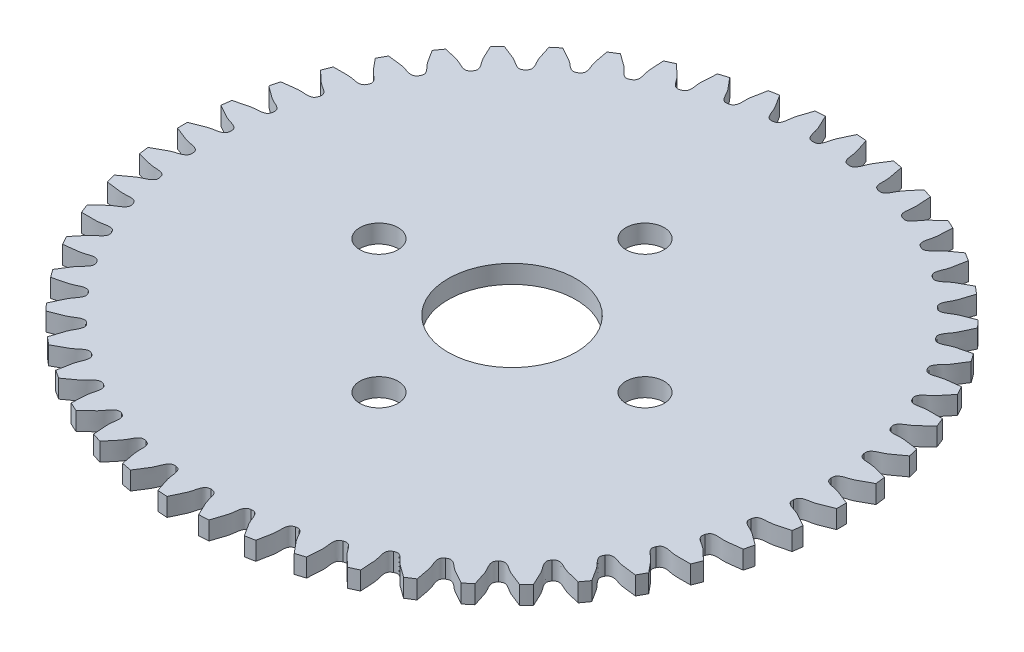
from build123d import *

# Parameters (mm, degrees)
SKETCH1_R      = 4
SKETCH1_R_2    = 1.2
EXTRUDE1_DEPTH = 1.143


with BuildPart() as part:
    # Sketch1 → Extrude1 (new body)
    with BuildSketch(Plane(origin=(0, 0, 0), x_dir=(1, 0, 0), z_dir=(0, 1, 0))):
        with BuildLine():
            ThreePointArc((-11.316727277, -17.257986267), (-11.058125481, -17.424817563), (-10.797064722, -17.587774152))
            add(Edge.make_bspline(
                [(-10.797064722, -17.587774152), (-10.668562717, -17.499911877), (-10.325145211, -17.265102752), (-9.872997884, -16.927766721), (-9.576781921, -16.550411077), (-9.287806909, -16.413373597), (-9.143697884, -16.479266354), (-9.076456009, -16.51001219)],
                knots=[0, 0, 0, 0, 0.220153706, 0.588353748, 0.785743053, 0.90002681, 1, 1, 1, 1], degree=3))
            add(Edge.make_bspline(
                [(-9.064492279, -18.540263913), (-9.059162524, -18.38468712), (-9.044918924, -17.968913109), (-9.002369346, -17.40639881), (-8.842477888, -16.954098135), (-8.881613871, -16.636680109), (-9.014466443, -16.55031194), (-9.076456009, -16.51001219)],
                knots=[0, 0, 0, 0, 0.220153706, 0.588353748, 0.785743053, 0.90002681, 1, 1, 1, 1], degree=3))
            ThreePointArc((-9.064492279, -18.540263913), (-8.78702013, -18.673368295), (-8.507594036, -18.802320335))
            add(Edge.make_bspline(
                [(-8.507594036, -18.802320335), (-8.39111737, -18.699045307), (-8.079837201, -18.423046096), (-7.673534607, -18.031700974), (-7.426949598, -17.620195187), (-7.15742859, -17.448020116), (-7.006197356, -17.495331639), (-6.935632229, -17.517407394)],
                knots=[0, 0, 0, 0, 0.220153706, 0.588353748, 0.785743053, 0.90002681, 1, 1, 1, 1], degree=3))
            add(Edge.make_bspline(
                [(-6.669304822, -19.530150523), (-6.683516037, -19.375132503), (-6.721495053, -18.960851798), (-6.749782727, -18.397440216), (-6.647840367, -17.928666353), (-6.726450779, -17.618656303), (-6.86908057, -17.549620015), (-6.935632229, -17.517407394)],
                knots=[0, 0, 0, 0, 0.220153706, 0.588353748, 0.785743053, 0.90002681, 1, 1, 1, 1], degree=3))
            ThreePointArc((-6.669304822, -19.530150523), (-6.377338221, -19.627428855), (-6.08395351, -19.720342693))
            add(Edge.make_bspline(
                [(-6.08395351, -19.720342693), (-5.981339091, -19.603283623), (-5.707105332, -19.290446998), (-5.353055105, -18.851264531), (-5.159989843, -18.412098294), (-4.914173348, -18.207500935), (-4.758204911, -18.235485093), (-4.685429385, -18.248542618)],
                knots=[0, 0, 0, 0, 0.220153706, 0.588353748, 0.785743053, 0.90002681, 1, 1, 1, 1], degree=3))
            add(Edge.make_bspline(
                [(-4.168938445, -20.212034991), (-4.202466509, -20.060020473), (-4.29206919, -19.653766528), (-4.390748002, -19.098343), (-4.348362433, -18.620488794), (-4.46520754, -18.322775762), (-4.615365194, -18.272160099), (-4.685429385, -18.248542618)],
                knots=[0, 0, 0, 0, 0.220153706, 0.588353748, 0.785743053, 0.90002681, 1, 1, 1, 1], degree=3))
            ThreePointArc((-4.168938445, -20.212034991), (-3.86708188, -20.271953137), (-3.564365403, -20.327363467))
            add(Edge.make_bspline(
                [(-3.564365403, -20.327363467), (-3.47723152, -20.198366446), (-3.244369003, -19.853626027), (-2.948154726, -19.373532385), (-2.811653966, -18.913631611), (-2.593418656, -18.679838588), (-2.435172732, -18.688054054), (-2.36133452, -18.691887424)],
                knots=[0, 0, 0, 0, 0.220153706, 0.588353748, 0.785743053, 0.90002681, 1, 1, 1, 1], degree=3))
            add(Edge.make_bspline(
                [(-1.602825418, -20.575163594), (-1.655141574, -20.428549936), (-1.794954832, -20.036729619), (-1.962468559, -19.498053506), (-1.980308225, -19.018655002), (-2.133545311, -18.737934102), (-2.288862752, -18.706537302), (-2.36133452, -18.691887424)],
                knots=[0, 0, 0, 0, 0.220153706, 0.588353748, 0.785743053, 0.90002681, 1, 1, 1, 1], degree=3))
            ThreePointArc((-1.602825418, -20.575163594), (-1.295839347, -20.596776608), (-0.988565124, -20.613809576))
            add(Edge.make_bspline(
                [(-0.988565124, -20.613809576), (-0.918285932, -20.474908964), (-0.730467036, -20.103701514), (-0.496760186, -19.590268061), (-0.418976626, -19.11688566), (-0.231764202, -18.857584027), (-0.073736424, -18.845901238), (0, -18.84045)],
                knots=[0, 0, 0, 0, 0.220153706, 0.588353748, 0.785743053, 0.90002681, 1, 1, 1, 1], degree=3))
            add(Edge.make_bspline(
                [(0.988565124, -20.613809576), (0.918285932, -20.474908964), (0.730467036, -20.103701514), (0.496760186, -19.590268061), (0.418976626, -19.11688566), (0.231764202, -18.857584027), (0.073736424, -18.845901238), (0, -18.84045)],
                knots=[0, 0, 0, 0, 0.220153706, 0.588353748, 0.785743053, 0.90002681, 1, 1, 1, 1], degree=3))
            ThreePointArc((0.988565124, -20.613809576), (1.295839347, -20.596776608), (1.602825418, -20.575163594))
            add(Edge.make_bspline(
                [(1.602825418, -20.575163594), (1.655141574, -20.428549936), (1.794954832, -20.036729619), (1.962468559, -19.498053506), (1.980308225, -19.018655002), (2.133545311, -18.737934102), (2.288862752, -18.706537302), (2.36133452, -18.691887424)],
                knots=[0, 0, 0, 0, 0.220153706, 0.588353748, 0.785743053, 0.90002681, 1, 1, 1, 1], degree=3))
            add(Edge.make_bspline(
                [(3.564365403, -20.327363467), (3.47723152, -20.198366446), (3.244369003, -19.853626027), (2.948154726, -19.373532385), (2.811653966, -18.913631611), (2.593418656, -18.679838588), (2.435172732, -18.688054054), (2.36133452, -18.691887424)],
                knots=[0, 0, 0, 0, 0.220153706, 0.588353748, 0.785743053, 0.90002681, 1, 1, 1, 1], degree=3))
            ThreePointArc((3.564365403, -20.327363467), (3.86708188, -20.271953137), (4.168938445, -20.212034991))
            add(Edge.make_bspline(
                [(4.168938445, -20.212034991), (4.202466509, -20.060020473), (4.29206919, -19.653766528), (4.390748002, -19.098343), (4.348362433, -18.620488794), (4.46520754, -18.322775762), (4.615365194, -18.272160099), (4.685429385, -18.248542618)],
                knots=[0, 0, 0, 0, 0.220153706, 0.588353748, 0.785743053, 0.90002681, 1, 1, 1, 1], degree=3))
            add(Edge.make_bspline(
                [(6.08395351, -19.720342693), (5.981339091, -19.603283623), (5.707105332, -19.290446998), (5.353055105, -18.851264531), (5.159989843, -18.412098294), (4.914173348, -18.207500935), (4.758204911, -18.235485093), (4.685429385, -18.248542618)],
                knots=[0, 0, 0, 0, 0.220153706, 0.588353748, 0.785743053, 0.90002681, 1, 1, 1, 1], degree=3))
            ThreePointArc((6.08395351, -19.720342693), (6.377338221, -19.627428855), (6.669304822, -19.530150523))
            add(Edge.make_bspline(
                [(6.669304822, -19.530150523), (6.683516037, -19.375132503), (6.721495053, -18.960851798), (6.749782727, -18.397440216), (6.647840367, -17.928666353), (6.726450779, -17.618656303), (6.86908057, -17.549620015), (6.935632229, -17.517407394)],
                knots=[0, 0, 0, 0, 0.220153706, 0.588353748, 0.785743053, 0.90002681, 1, 1, 1, 1], degree=3))
            add(Edge.make_bspline(
                [(8.507594036, -18.802320335), (8.39111737, -18.699045307), (8.079837201, -18.423046096), (7.673534607, -18.031700974), (7.426949598, -17.620195187), (7.15742859, -17.448020116), (7.006197356, -17.495331639), (6.935632229, -17.517407394)],
                knots=[0, 0, 0, 0, 0.220153706, 0.588353748, 0.785743053, 0.90002681, 1, 1, 1, 1], degree=3))
            ThreePointArc((8.507594036, -18.802320335), (8.78702013, -18.673368295), (9.064492279, -18.540263913))
            add(Edge.make_bspline(
                [(9.064492279, -18.540263913), (9.059162524, -18.38468712), (9.044918924, -17.968913109), (9.002369346, -17.40639881), (8.842477888, -16.954098135), (8.881613871, -16.636680109), (9.014466443, -16.55031194), (9.076456009, -16.51001219)],
                knots=[0, 0, 0, 0, 0.220153706, 0.588353748, 0.785743053, 0.90002681, 1, 1, 1, 1], degree=3))
            add(Edge.make_bspline(
                [(10.797064722, -17.587774152), (10.668562717, -17.499911877), (10.325145211, -17.265102752), (9.872997884, -16.927766721), (9.576781921, -16.550411077), (9.287806909, -16.413373597), (9.143697884, -16.479266354), (9.076456009, -16.51001219)],
                knots=[0, 0, 0, 0, 0.220153706, 0.588353748, 0.785743053, 0.90002681, 1, 1, 1, 1], degree=3))
            ThreePointArc((10.797064722, -17.587774152), (11.058125481, -17.424817563), (11.316727277, -17.257986267))
            add(Edge.make_bspline(
                [(11.316727277, -17.257986267), (11.291940606, -17.104304238), (11.225699021, -16.693593926), (11.112983222, -16.140848097), (10.89766425, -15.712153661), (10.896708607, -15.392333531), (11.017688794, -15.289995559), (11.074138657, -15.242244232)],
                knots=[0, 0, 0, 0, 0.220153706, 0.588353748, 0.785743053, 0.90002681, 1, 1, 1, 1], degree=3))
            add(Edge.make_bspline(
                [(12.916259248, -16.095858265), (12.777758456, -16.024794382), (12.407619512, -15.834878424), (11.916758087, -15.556871474), (11.575582672, -15.219617097), (11.271710963, -15.119878371), (11.136996834, -15.203313194), (11.074138657, -15.242244232)],
                knots=[0, 0, 0, 0, 0.220153706, 0.588353748, 0.785743053, 0.90002681, 1, 1, 1, 1], degree=3))
            ThreePointArc((12.916259248, -16.095858265), (13.154837588, -15.901467048), (13.390490726, -15.703539867))
            add(Edge.make_bspline(
                [(13.390490726, -15.703539867), (13.34663804, -15.554176261), (13.229443137, -15.155006794), (13.048338714, -14.620746567), (12.780987937, -14.222419137), (12.739955738, -13.905240659), (12.847155612, -13.788546814), (12.897175522, -13.734096977)],
                knots=[0, 0, 0, 0, 0.220153706, 0.588353748, 0.785743053, 0.90002681, 1, 1, 1, 1], degree=3))
            add(Edge.make_bspline(
                [(14.831756649, -14.350101078), (14.685441311, -14.296956307), (14.294418243, -14.154928603), (13.772583896, -13.940635071), (13.391829569, -13.648800663), (13.077853403, -13.587933631), (12.954658691, -13.687594703), (12.897175522, -13.734096977)],
                knots=[0, 0, 0, 0, 0.220153706, 0.588353748, 0.785743053, 0.90002681, 1, 1, 1, 1], degree=3))
            ThreePointArc((14.831756649, -14.350101078), (15.044090048, -14.127340899), (15.253078137, -13.901439263))
            add(Edge.make_bspline(
                [(15.253078137, -13.901439263), (15.190851019, -13.758749633), (15.024551033, -13.377416152), (14.777914111, -12.870067129), (14.462747809, -12.508388568), (14.382286157, -12.198853835), (14.474015111, -12.069644449), (14.516816225, -12.009354808)],
                knots=[0, 0, 0, 0, 0.220153706, 0.588353748, 0.785743053, 0.90002681, 1, 1, 1, 1], degree=3))
            add(Edge.make_bspline(
                [(16.513348388, -12.378034225), (16.361525984, -12.34364669), (15.955785458, -12.251747103), (15.41120783, -12.104546526), (14.996879314, -11.86273449), (14.677750282, -11.841699061), (14.568017842, -11.956014667), (14.516816225, -12.009354808)],
                knots=[0, 0, 0, 0, 0.220153706, 0.588353748, 0.785743053, 0.90002681, 1, 1, 1, 1], degree=3))
            ThreePointArc((16.513348388, -12.378034225), (16.696088221, -12.130418144), (16.875115394, -11.880104658))
            add(Edge.make_bspline(
                [(16.875115394, -11.880104658), (16.795495203, -11.746339303), (16.582712784, -11.388855667), (16.274432973, -10.916419045), (15.916421509, -10.597093239), (15.797799332, -10.300083799), (15.872610745, -10.160396581), (15.907518064, -10.095217939)],
                knots=[0, 0, 0, 0, 0.220153706, 0.588353748, 0.785743053, 0.90002681, 1, 1, 1, 1], degree=3))
            add(Edge.make_bspline(
                [(17.934514758, -10.210758377), (17.779579618, -10.195670392), (17.365520405, -10.155348232), (16.80678781, -10.077562051), (16.365419314, -9.889585908), (16.046170272, -9.908713822), (15.951630648, -10.035881137), (15.907518064, -10.095217939)],
                knots=[0, 0, 0, 0, 0.220153706, 0.588353748, 0.785743053, 0.90002681, 1, 1, 1, 1], degree=3))
            ThreePointArc((17.934514758, -10.210758377), (18.084779109, -9.942191449), (18.231022001, -9.671413705))
            add(Edge.make_bspline(
                [(18.231022001, -9.671413705), (18.135264394, -9.548682187), (17.879355248, -9.220686124), (17.514294306, -8.790612511), (17.119083733, -8.518675419), (16.964171774, -8.238875288), (17.020885826, -8.090913189), (17.047348841, -8.021873454)],
                knots=[0, 0, 0, 0, 0.220153706, 0.588353748, 0.785743053, 0.90002681, 1, 1, 1, 1], degree=3))
            add(Edge.make_bspline(
                [(19.072843117, -7.882452771), (18.917238661, -7.88690228), (18.501390722, -7.898793453), (17.937314706, -7.891648402), (17.475866875, -7.760472648), (17.16153257, -7.819462248), (17.083676711, -7.957475767), (17.047348841, -8.021873454)],
                knots=[0, 0, 0, 0, 0.220153706, 0.588353748, 0.785743053, 0.90002681, 1, 1, 1, 1], degree=3))
            ThreePointArc((19.072843117, -7.882452771), (19.188262228, -7.597170456), (19.2994145, -7.310198781))
            add(Edge.make_bspline(
                [(19.2994145, -7.310198781), (19.189029632, -7.200436647), (18.894029599, -6.907100852), (18.477944756, -6.526172767), (18.051767781, -6.305912999), (17.863009094, -6.047734792), (17.90073137, -5.893831263), (17.918332742, -5.822019232)],
                knots=[0, 0, 0, 0, 0.220153706, 0.588353748, 0.785743053, 0.90002681, 1, 1, 1, 1], degree=3))
            add(Edge.make_bspline(
                [(19.910381346, -5.429836175), (19.756561549, -5.453753009), (19.345483055, -5.517669983), (18.784959435, -5.581278743), (18.310709576, -5.508972098), (18.006247248, -5.606893083), (17.946302986, -5.753576251), (17.918332742, -5.822019232)],
                knots=[0, 0, 0, 0, 0.220153706, 0.588353748, 0.785743053, 0.90002681, 1, 1, 1, 1], degree=3))
            ThreePointArc((19.910381346, -5.429836175), (19.989134988, -5.132337546), (20.063443703, -4.833697655))
            add(Edge.make_bspline(
                [(20.063443703, -4.833697655), (19.94017241, -4.738635921), (19.610733816, -4.484586474), (19.150186978, -4.15881138), (18.699764667, -3.993702564), (18.480136089, -3.761217906), (18.498271687, -3.603800098), (18.506733833, -3.530348288)],
                knots=[0, 0, 0, 0, 0.220153706, 0.588353748, 0.785743053, 0.90002681, 1, 1, 1, 1], degree=3))
            add(Edge.make_bspline(
                [(20.433920968, -2.891587819), (20.28431166, -2.934594794), (19.884485563, -3.049529561), (19.336354131, -3.182888985), (18.856781449, -3.170591767), (18.566992651, -3.305899864), (18.525905343, -3.4589394), (18.506733833, -3.530348288)],
                knots=[0, 0, 0, 0, 0.220153706, 0.588353748, 0.785743053, 0.90002681, 1, 1, 1, 1], degree=3))
            ThreePointArc((20.433920968, -2.891587819), (20.474767148, -2.586564608), (20.511060414, -2.280966229))
            add(Edge.make_bspline(
                [(20.511060414, -2.280966229), (20.376846757, -2.202104075), (20.018165047, -1.991347489), (19.520419311, -1.725863052), (19.052855093, -1.618509054), (18.805820298, -1.415384367), (18.804083209, -1.256934852), (18.803272676, -1.183001644)],
                knots=[0, 0, 0, 0, 0.220153706, 0.588353748, 0.785743053, 0.90002681, 1, 1, 1, 1], degree=3))
            add(Edge.make_bspline(
                [(20.63520545, -0.307737396), (20.492166059, -0.369156267), (20.109897856, -0.533296236), (19.582802972, -0.734303166), (19.105470613, -0.782209311), (18.834925488, -0.95277063), (18.813343106, -1.109753008), (18.803272676, -1.183001644)],
                knots=[0, 0, 0, 0, 0.220153706, 0.588353748, 0.785743053, 0.90002681, 1, 1, 1, 1], degree=3))
            ThreePointArc((20.63520545, -0.307737396), (20.6375, 0), (20.63520545, 0.307737396))
            add(Edge.make_bspline(
                [(20.63520545, 0.307737396), (20.492166059, 0.369156267), (20.109897856, 0.533296236), (19.582802972, 0.734303166), (19.105470613, 0.782209311), (18.834925488, 0.95277063), (18.813343106, 1.109753008), (18.803272676, 1.183001644)],
                knots=[0, 0, 0, 0, 0.220153706, 0.588353748, 0.785743053, 0.90002681, 1, 1, 1, 1], degree=3))
            add(Edge.make_bspline(
                [(20.511060414, 2.280966229), (20.376846757, 2.202104075), (20.018165047, 1.991347489), (19.520419311, 1.725863052), (19.052855093, 1.618509054), (18.805820298, 1.415384367), (18.804083209, 1.256934852), (18.803272676, 1.183001644)],
                knots=[0, 0, 0, 0, 0.220153706, 0.588353748, 0.785743053, 0.90002681, 1, 1, 1, 1], degree=3))
            ThreePointArc((20.511060414, 2.280966229), (20.474767148, 2.586564608), (20.433920968, 2.891587819))
            add(Edge.make_bspline(
                [(20.433920968, 2.891587819), (20.28431166, 2.934594794), (19.884485563, 3.049529561), (19.336354131, 3.182888985), (18.856781449, 3.170591767), (18.566992651, 3.305899864), (18.525905343, 3.4589394), (18.506733833, 3.530348288)],
                knots=[0, 0, 0, 0, 0.220153706, 0.588353748, 0.785743053, 0.90002681, 1, 1, 1, 1], degree=3))
            add(Edge.make_bspline(
                [(20.063443703, 4.833697655), (19.94017241, 4.738635921), (19.610733816, 4.484586474), (19.150186978, 4.15881138), (18.699764667, 3.993702564), (18.480136089, 3.761217906), (18.498271687, 3.603800098), (18.506733833, 3.530348288)],
                knots=[0, 0, 0, 0, 0.220153706, 0.588353748, 0.785743053, 0.90002681, 1, 1, 1, 1], degree=3))
            ThreePointArc((20.063443703, 4.833697655), (19.989134988, 5.132337546), (19.910381346, 5.429836175))
            add(Edge.make_bspline(
                [(19.910381346, 5.429836175), (19.756561549, 5.453753009), (19.345483055, 5.517669983), (18.784959435, 5.581278743), (18.310709576, 5.508972098), (18.006247248, 5.606893083), (17.946302986, 5.753576251), (17.918332742, 5.822019232)],
                knots=[0, 0, 0, 0, 0.220153706, 0.588353748, 0.785743053, 0.90002681, 1, 1, 1, 1], degree=3))
            add(Edge.make_bspline(
                [(19.2994145, 7.310198781), (19.189029632, 7.200436647), (18.894029599, 6.907100852), (18.477944756, 6.526172767), (18.051767781, 6.305912999), (17.863009094, 6.047734792), (17.90073137, 5.893831263), (17.918332742, 5.822019232)],
                knots=[0, 0, 0, 0, 0.220153706, 0.588353748, 0.785743053, 0.90002681, 1, 1, 1, 1], degree=3))
            ThreePointArc((19.2994145, 7.310198781), (19.188262228, 7.597170456), (19.072843117, 7.882452771))
            add(Edge.make_bspline(
                [(19.072843117, 7.882452771), (18.917238661, 7.88690228), (18.501390722, 7.898793453), (17.937314706, 7.891648402), (17.475866875, 7.760472648), (17.16153257, 7.819462248), (17.083676711, 7.957475767), (17.047348841, 8.021873454)],
                knots=[0, 0, 0, 0, 0.220153706, 0.588353748, 0.785743053, 0.90002681, 1, 1, 1, 1], degree=3))
            add(Edge.make_bspline(
                [(18.231022001, 9.671413705), (18.135264394, 9.548682187), (17.879355248, 9.220686124), (17.514294306, 8.790612511), (17.119083733, 8.518675419), (16.964171774, 8.238875288), (17.020885826, 8.090913189), (17.047348841, 8.021873454)],
                knots=[0, 0, 0, 0, 0.220153706, 0.588353748, 0.785743053, 0.90002681, 1, 1, 1, 1], degree=3))
            ThreePointArc((18.231022001, 9.671413705), (18.084779109, 9.942191449), (17.934514758, 10.210758377))
            add(Edge.make_bspline(
                [(17.934514758, 10.210758377), (17.779579618, 10.195670392), (17.365520405, 10.155348232), (16.80678781, 10.077562051), (16.365419314, 9.889585908), (16.046170272, 9.908713822), (15.951630648, 10.035881137), (15.907518064, 10.095217939)],
                knots=[0, 0, 0, 0, 0.220153706, 0.588353748, 0.785743053, 0.90002681, 1, 1, 1, 1], degree=3))
            add(Edge.make_bspline(
                [(16.875115394, 11.880104658), (16.795495203, 11.746339303), (16.582712784, 11.388855667), (16.274432973, 10.916419045), (15.916421509, 10.597093239), (15.797799332, 10.300083799), (15.872610745, 10.160396581), (15.907518064, 10.095217939)],
                knots=[0, 0, 0, 0, 0.220153706, 0.588353748, 0.785743053, 0.90002681, 1, 1, 1, 1], degree=3))
            ThreePointArc((16.875115394, 11.880104658), (16.696088221, 12.130418144), (16.513348388, 12.378034225))
            add(Edge.make_bspline(
                [(16.513348388, 12.378034225), (16.361525984, 12.34364669), (15.955785458, 12.251747103), (15.41120783, 12.104546526), (14.996879314, 11.86273449), (14.677750282, 11.841699061), (14.568017842, 11.956014667), (14.516816225, 12.009354808)],
                knots=[0, 0, 0, 0, 0.220153706, 0.588353748, 0.785743053, 0.90002681, 1, 1, 1, 1], degree=3))
            add(Edge.make_bspline(
                [(15.253078137, 13.901439263), (15.190851019, 13.758749633), (15.024551033, 13.377416152), (14.777914111, 12.870067129), (14.462747809, 12.508388568), (14.382286157, 12.198853835), (14.474015111, 12.069644449), (14.516816225, 12.009354808)],
                knots=[0, 0, 0, 0, 0.220153706, 0.588353748, 0.785743053, 0.90002681, 1, 1, 1, 1], degree=3))
            ThreePointArc((15.253078137, 13.901439263), (15.044090048, 14.127340899), (14.831756649, 14.350101078))
            add(Edge.make_bspline(
                [(14.831756649, 14.350101078), (14.685441311, 14.296956307), (14.294418243, 14.154928603), (13.772583896, 13.940635071), (13.391829569, 13.648800663), (13.077853403, 13.587933631), (12.954658691, 13.687594703), (12.897175522, 13.734096977)],
                knots=[0, 0, 0, 0, 0.220153706, 0.588353748, 0.785743053, 0.90002681, 1, 1, 1, 1], degree=3))
            add(Edge.make_bspline(
                [(13.390490726, 15.703539867), (13.34663804, 15.554176261), (13.229443137, 15.155006794), (13.048338714, 14.620746567), (12.780987937, 14.222419137), (12.739955738, 13.905240659), (12.847155612, 13.788546814), (12.897175522, 13.734096977)],
                knots=[0, 0, 0, 0, 0.220153706, 0.588353748, 0.785743053, 0.90002681, 1, 1, 1, 1], degree=3))
            ThreePointArc((13.390490726, 15.703539867), (13.154837588, 15.901467048), (12.916259248, 16.095858265))
            add(Edge.make_bspline(
                [(12.916259248, 16.095858265), (12.777758456, 16.024794382), (12.407619512, 15.834878424), (11.916758087, 15.556871474), (11.575582672, 15.219617097), (11.271710963, 15.119878371), (11.136996834, 15.203313194), (11.074138657, 15.242244232)],
                knots=[0, 0, 0, 0, 0.220153706, 0.588353748, 0.785743053, 0.90002681, 1, 1, 1, 1], degree=3))
            add(Edge.make_bspline(
                [(11.316727277, 17.257986267), (11.291940606, 17.104304238), (11.225699021, 16.693593926), (11.112983222, 16.140848097), (10.89766425, 15.712153661), (10.896708607, 15.392333531), (11.017688794, 15.289995559), (11.074138657, 15.242244232)],
                knots=[0, 0, 0, 0, 0.220153706, 0.588353748, 0.785743053, 0.90002681, 1, 1, 1, 1], degree=3))
            ThreePointArc((11.316727277, 17.257986267), (11.058125481, 17.424817563), (10.797064722, 17.587774152))
            add(Edge.make_bspline(
                [(10.797064722, 17.587774152), (10.668562717, 17.499911877), (10.325145211, 17.265102752), (9.872997884, 16.927766721), (9.576781921, 16.550411077), (9.287806909, 16.413373597), (9.143697884, 16.479266354), (9.076456009, 16.51001219)],
                knots=[0, 0, 0, 0, 0.220153706, 0.588353748, 0.785743053, 0.90002681, 1, 1, 1, 1], degree=3))
            add(Edge.make_bspline(
                [(9.064492279, 18.540263913), (9.059162524, 18.38468712), (9.044918924, 17.968913109), (9.002369346, 17.40639881), (8.842477888, 16.954098135), (8.881613871, 16.636680109), (9.014466443, 16.55031194), (9.076456009, 16.51001219)],
                knots=[0, 0, 0, 0, 0.220153706, 0.588353748, 0.785743053, 0.90002681, 1, 1, 1, 1], degree=3))
            ThreePointArc((9.064492279, 18.540263913), (8.78702013, 18.673368295), (8.507594036, 18.802320335))
            add(Edge.make_bspline(
                [(8.507594036, 18.802320335), (8.39111737, 18.699045307), (8.079837201, 18.423046096), (7.673534607, 18.031700974), (7.426949598, 17.620195187), (7.15742859, 17.448020116), (7.006197356, 17.495331639), (6.935632229, 17.517407394)],
                knots=[0, 0, 0, 0, 0.220153706, 0.588353748, 0.785743053, 0.90002681, 1, 1, 1, 1], degree=3))
            add(Edge.make_bspline(
                [(6.669304822, 19.530150523), (6.683516037, 19.375132503), (6.721495053, 18.960851798), (6.749782727, 18.397440216), (6.647840367, 17.928666353), (6.726450779, 17.618656303), (6.86908057, 17.549620015), (6.935632229, 17.517407394)],
                knots=[0, 0, 0, 0, 0.220153706, 0.588353748, 0.785743053, 0.90002681, 1, 1, 1, 1], degree=3))
            ThreePointArc((6.669304822, 19.530150523), (6.377338221, 19.627428855), (6.08395351, 19.720342693))
            add(Edge.make_bspline(
                [(6.08395351, 19.720342693), (5.981339091, 19.603283623), (5.707105332, 19.290446998), (5.353055105, 18.851264531), (5.159989843, 18.412098294), (4.914173348, 18.207500935), (4.758204911, 18.235485093), (4.685429385, 18.248542618)],
                knots=[0, 0, 0, 0, 0.220153706, 0.588353748, 0.785743053, 0.90002681, 1, 1, 1, 1], degree=3))
            add(Edge.make_bspline(
                [(4.168938445, 20.212034991), (4.202466509, 20.060020473), (4.29206919, 19.653766528), (4.390748002, 19.098343), (4.348362433, 18.620488794), (4.46520754, 18.322775762), (4.615365194, 18.272160099), (4.685429385, 18.248542618)],
                knots=[0, 0, 0, 0, 0.220153706, 0.588353748, 0.785743053, 0.90002681, 1, 1, 1, 1], degree=3))
            ThreePointArc((4.168938445, 20.212034991), (3.86708188, 20.271953137), (3.564365403, 20.327363467))
            add(Edge.make_bspline(
                [(3.564365403, 20.327363467), (3.47723152, 20.198366446), (3.244369003, 19.853626027), (2.948154726, 19.373532385), (2.811653966, 18.913631611), (2.593418656, 18.679838588), (2.435172732, 18.688054054), (2.36133452, 18.691887424)],
                knots=[0, 0, 0, 0, 0.220153706, 0.588353748, 0.785743053, 0.90002681, 1, 1, 1, 1], degree=3))
            add(Edge.make_bspline(
                [(1.602825418, 20.575163594), (1.655141574, 20.428549936), (1.794954832, 20.036729619), (1.962468559, 19.498053506), (1.980308225, 19.018655002), (2.133545311, 18.737934102), (2.288862752, 18.706537302), (2.36133452, 18.691887424)],
                knots=[0, 0, 0, 0, 0.220153706, 0.588353748, 0.785743053, 0.90002681, 1, 1, 1, 1], degree=3))
            ThreePointArc((1.602825418, 20.575163594), (1.295839347, 20.596776608), (0.988565124, 20.613809576))
            add(Edge.make_bspline(
                [(0.988565124, 20.613809576), (0.918285932, 20.474908964), (0.730467036, 20.103701514), (0.496760186, 19.590268061), (0.418976626, 19.11688566), (0.231764202, 18.857584027), (0.073736424, 18.845901238), (0, 18.84045)],
                knots=[0, 0, 0, 0, 0.220153706, 0.588353748, 0.785743053, 0.90002681, 1, 1, 1, 1], degree=3))
            add(Edge.make_bspline(
                [(-0.988565124, 20.613809576), (-0.918285932, 20.474908964), (-0.730467036, 20.103701514), (-0.496760186, 19.590268061), (-0.418976626, 19.11688566), (-0.231764202, 18.857584027), (-0.073736424, 18.845901238), (0, 18.84045)],
                knots=[0, 0, 0, 0, 0.220153706, 0.588353748, 0.785743053, 0.90002681, 1, 1, 1, 1], degree=3))
            ThreePointArc((-0.988565124, 20.613809576), (-1.295839347, 20.596776608), (-1.602825418, 20.575163594))
            add(Edge.make_bspline(
                [(-1.602825418, 20.575163594), (-1.655141574, 20.428549936), (-1.794954832, 20.036729619), (-1.962468559, 19.498053506), (-1.980308225, 19.018655002), (-2.133545311, 18.737934102), (-2.288862752, 18.706537302), (-2.36133452, 18.691887424)],
                knots=[0, 0, 0, 0, 0.220153706, 0.588353748, 0.785743053, 0.90002681, 1, 1, 1, 1], degree=3))
            add(Edge.make_bspline(
                [(-3.564365403, 20.327363467), (-3.47723152, 20.198366446), (-3.244369003, 19.853626027), (-2.948154726, 19.373532385), (-2.811653966, 18.913631611), (-2.593418656, 18.679838588), (-2.435172732, 18.688054054), (-2.36133452, 18.691887424)],
                knots=[0, 0, 0, 0, 0.220153706, 0.588353748, 0.785743053, 0.90002681, 1, 1, 1, 1], degree=3))
            ThreePointArc((-3.564365403, 20.327363467), (-3.86708188, 20.271953137), (-4.168938445, 20.212034991))
            add(Edge.make_bspline(
                [(-4.168938445, 20.212034991), (-4.202466509, 20.060020473), (-4.29206919, 19.653766528), (-4.390748002, 19.098343), (-4.348362433, 18.620488794), (-4.46520754, 18.322775762), (-4.615365194, 18.272160099), (-4.685429385, 18.248542618)],
                knots=[0, 0, 0, 0, 0.220153706, 0.588353748, 0.785743053, 0.90002681, 1, 1, 1, 1], degree=3))
            add(Edge.make_bspline(
                [(-6.08395351, 19.720342693), (-5.981339091, 19.603283623), (-5.707105332, 19.290446998), (-5.353055105, 18.851264531), (-5.159989843, 18.412098294), (-4.914173348, 18.207500935), (-4.758204911, 18.235485093), (-4.685429385, 18.248542618)],
                knots=[0, 0, 0, 0, 0.220153706, 0.588353748, 0.785743053, 0.90002681, 1, 1, 1, 1], degree=3))
            ThreePointArc((-6.08395351, 19.720342693), (-6.377338221, 19.627428855), (-6.669304822, 19.530150523))
            add(Edge.make_bspline(
                [(-6.669304822, 19.530150523), (-6.683516037, 19.375132503), (-6.721495053, 18.960851798), (-6.749782727, 18.397440216), (-6.647840367, 17.928666353), (-6.726450779, 17.618656303), (-6.86908057, 17.549620015), (-6.935632229, 17.517407394)],
                knots=[0, 0, 0, 0, 0.220153706, 0.588353748, 0.785743053, 0.90002681, 1, 1, 1, 1], degree=3))
            add(Edge.make_bspline(
                [(-8.507594036, 18.802320335), (-8.39111737, 18.699045307), (-8.079837201, 18.423046096), (-7.673534607, 18.031700974), (-7.426949598, 17.620195187), (-7.15742859, 17.448020116), (-7.006197356, 17.495331639), (-6.935632229, 17.517407394)],
                knots=[0, 0, 0, 0, 0.220153706, 0.588353748, 0.785743053, 0.90002681, 1, 1, 1, 1], degree=3))
            ThreePointArc((-8.507594036, 18.802320335), (-8.78702013, 18.673368295), (-9.064492279, 18.540263913))
            add(Edge.make_bspline(
                [(-9.064492279, 18.540263913), (-9.059162524, 18.38468712), (-9.044918924, 17.968913109), (-9.002369346, 17.40639881), (-8.842477888, 16.954098135), (-8.881613871, 16.636680109), (-9.014466443, 16.55031194), (-9.076456009, 16.51001219)],
                knots=[0, 0, 0, 0, 0.220153706, 0.588353748, 0.785743053, 0.90002681, 1, 1, 1, 1], degree=3))
            add(Edge.make_bspline(
                [(-10.797064722, 17.587774152), (-10.668562717, 17.499911877), (-10.325145211, 17.265102752), (-9.872997884, 16.927766721), (-9.576781921, 16.550411077), (-9.287806909, 16.413373597), (-9.143697884, 16.479266354), (-9.076456009, 16.51001219)],
                knots=[0, 0, 0, 0, 0.220153706, 0.588353748, 0.785743053, 0.90002681, 1, 1, 1, 1], degree=3))
            ThreePointArc((-10.797064722, 17.587774152), (-11.058125481, 17.424817563), (-11.316727277, 17.257986267))
            add(Edge.make_bspline(
                [(-11.316727277, 17.257986267), (-11.291940606, 17.104304238), (-11.225699021, 16.693593926), (-11.112983222, 16.140848097), (-10.89766425, 15.712153661), (-10.896708607, 15.392333531), (-11.017688794, 15.289995559), (-11.074138657, 15.242244232)],
                knots=[0, 0, 0, 0, 0.220153706, 0.588353748, 0.785743053, 0.90002681, 1, 1, 1, 1], degree=3))
            add(Edge.make_bspline(
                [(-12.916259248, 16.095858265), (-12.777758456, 16.024794382), (-12.407619512, 15.834878424), (-11.916758087, 15.556871474), (-11.575582672, 15.219617097), (-11.271710963, 15.119878371), (-11.136996834, 15.203313194), (-11.074138657, 15.242244232)],
                knots=[0, 0, 0, 0, 0.220153706, 0.588353748, 0.785743053, 0.90002681, 1, 1, 1, 1], degree=3))
            ThreePointArc((-12.916259248, 16.095858265), (-13.154837588, 15.901467048), (-13.390490726, 15.703539867))
            add(Edge.make_bspline(
                [(-13.390490726, 15.703539867), (-13.34663804, 15.554176261), (-13.229443137, 15.155006794), (-13.048338714, 14.620746567), (-12.780987937, 14.222419137), (-12.739955738, 13.905240659), (-12.847155612, 13.788546814), (-12.897175522, 13.734096977)],
                knots=[0, 0, 0, 0, 0.220153706, 0.588353748, 0.785743053, 0.90002681, 1, 1, 1, 1], degree=3))
            add(Edge.make_bspline(
                [(-14.831756649, 14.350101078), (-14.685441311, 14.296956307), (-14.294418243, 14.154928603), (-13.772583896, 13.940635071), (-13.391829569, 13.648800663), (-13.077853403, 13.587933631), (-12.954658691, 13.687594703), (-12.897175522, 13.734096977)],
                knots=[0, 0, 0, 0, 0.220153706, 0.588353748, 0.785743053, 0.90002681, 1, 1, 1, 1], degree=3))
            ThreePointArc((-14.831756649, 14.350101078), (-15.044090048, 14.127340899), (-15.253078137, 13.901439263))
            add(Edge.make_bspline(
                [(-15.253078137, 13.901439263), (-15.190851019, 13.758749633), (-15.024551033, 13.377416152), (-14.777914111, 12.870067129), (-14.462747809, 12.508388568), (-14.382286157, 12.198853835), (-14.474015111, 12.069644449), (-14.516816225, 12.009354808)],
                knots=[0, 0, 0, 0, 0.220153706, 0.588353748, 0.785743053, 0.90002681, 1, 1, 1, 1], degree=3))
            add(Edge.make_bspline(
                [(-16.513348388, 12.378034225), (-16.361525984, 12.34364669), (-15.955785458, 12.251747103), (-15.41120783, 12.104546526), (-14.996879314, 11.86273449), (-14.677750282, 11.841699061), (-14.568017842, 11.956014667), (-14.516816225, 12.009354808)],
                knots=[0, 0, 0, 0, 0.220153706, 0.588353748, 0.785743053, 0.90002681, 1, 1, 1, 1], degree=3))
            ThreePointArc((-16.513348388, 12.378034225), (-16.696088221, 12.130418144), (-16.875115394, 11.880104658))
            add(Edge.make_bspline(
                [(-16.875115394, 11.880104658), (-16.795495203, 11.746339303), (-16.582712784, 11.388855667), (-16.274432973, 10.916419045), (-15.916421509, 10.597093239), (-15.797799332, 10.300083799), (-15.872610745, 10.160396581), (-15.907518064, 10.095217939)],
                knots=[0, 0, 0, 0, 0.220153706, 0.588353748, 0.785743053, 0.90002681, 1, 1, 1, 1], degree=3))
            add(Edge.make_bspline(
                [(-17.934514758, 10.210758377), (-17.779579618, 10.195670392), (-17.365520405, 10.155348232), (-16.80678781, 10.077562051), (-16.365419314, 9.889585908), (-16.046170272, 9.908713822), (-15.951630648, 10.035881137), (-15.907518064, 10.095217939)],
                knots=[0, 0, 0, 0, 0.220153706, 0.588353748, 0.785743053, 0.90002681, 1, 1, 1, 1], degree=3))
            ThreePointArc((-17.934514758, 10.210758377), (-18.084779109, 9.942191449), (-18.231022001, 9.671413705))
            add(Edge.make_bspline(
                [(-18.231022001, 9.671413705), (-18.135264394, 9.548682187), (-17.879355248, 9.220686124), (-17.514294306, 8.790612511), (-17.119083733, 8.518675419), (-16.964171774, 8.238875288), (-17.020885826, 8.090913189), (-17.047348841, 8.021873454)],
                knots=[0, 0, 0, 0, 0.220153706, 0.588353748, 0.785743053, 0.90002681, 1, 1, 1, 1], degree=3))
            add(Edge.make_bspline(
                [(-19.072843117, 7.882452771), (-18.917238661, 7.88690228), (-18.501390722, 7.898793453), (-17.937314706, 7.891648402), (-17.475866875, 7.760472648), (-17.16153257, 7.819462248), (-17.083676711, 7.957475767), (-17.047348841, 8.021873454)],
                knots=[0, 0, 0, 0, 0.220153706, 0.588353748, 0.785743053, 0.90002681, 1, 1, 1, 1], degree=3))
            ThreePointArc((-19.072843117, 7.882452771), (-19.188262228, 7.597170456), (-19.2994145, 7.310198781))
            add(Edge.make_bspline(
                [(-19.2994145, 7.310198781), (-19.189029632, 7.200436647), (-18.894029599, 6.907100852), (-18.477944756, 6.526172767), (-18.051767781, 6.305912999), (-17.863009094, 6.047734792), (-17.90073137, 5.893831263), (-17.918332742, 5.822019232)],
                knots=[0, 0, 0, 0, 0.220153706, 0.588353748, 0.785743053, 0.90002681, 1, 1, 1, 1], degree=3))
            add(Edge.make_bspline(
                [(-19.910381346, 5.429836175), (-19.756561549, 5.453753009), (-19.345483055, 5.517669983), (-18.784959435, 5.581278743), (-18.310709576, 5.508972098), (-18.006247248, 5.606893083), (-17.946302986, 5.753576251), (-17.918332742, 5.822019232)],
                knots=[0, 0, 0, 0, 0.220153706, 0.588353748, 0.785743053, 0.90002681, 1, 1, 1, 1], degree=3))
            ThreePointArc((-19.910381346, 5.429836175), (-19.989134988, 5.132337546), (-20.063443703, 4.833697655))
            add(Edge.make_bspline(
                [(-20.063443703, 4.833697655), (-19.94017241, 4.738635921), (-19.610733816, 4.484586474), (-19.150186978, 4.15881138), (-18.699764667, 3.993702564), (-18.480136089, 3.761217906), (-18.498271687, 3.603800098), (-18.506733833, 3.530348288)],
                knots=[0, 0, 0, 0, 0.220153706, 0.588353748, 0.785743053, 0.90002681, 1, 1, 1, 1], degree=3))
            add(Edge.make_bspline(
                [(-20.433920968, 2.891587819), (-20.28431166, 2.934594794), (-19.884485563, 3.049529561), (-19.336354131, 3.182888985), (-18.856781449, 3.170591767), (-18.566992651, 3.305899864), (-18.525905343, 3.4589394), (-18.506733833, 3.530348288)],
                knots=[0, 0, 0, 0, 0.220153706, 0.588353748, 0.785743053, 0.90002681, 1, 1, 1, 1], degree=3))
            ThreePointArc((-20.433920968, 2.891587819), (-20.474767148, 2.586564608), (-20.511060414, 2.280966229))
            add(Edge.make_bspline(
                [(-20.511060414, 2.280966229), (-20.376846757, 2.202104075), (-20.018165047, 1.991347489), (-19.520419311, 1.725863052), (-19.052855093, 1.618509054), (-18.805820298, 1.415384367), (-18.804083209, 1.256934852), (-18.803272676, 1.183001644)],
                knots=[0, 0, 0, 0, 0.220153706, 0.588353748, 0.785743053, 0.90002681, 1, 1, 1, 1], degree=3))
            add(Edge.make_bspline(
                [(-20.63520545, 0.307737396), (-20.492166059, 0.369156267), (-20.109897856, 0.533296236), (-19.582802972, 0.734303166), (-19.105470613, 0.782209311), (-18.834925488, 0.95277063), (-18.813343106, 1.109753008), (-18.803272676, 1.183001644)],
                knots=[0, 0, 0, 0, 0.220153706, 0.588353748, 0.785743053, 0.90002681, 1, 1, 1, 1], degree=3))
            ThreePointArc((-20.63520545, 0.307737396), (-20.6375, 0), (-20.63520545, -0.307737396))
            add(Edge.make_bspline(
                [(-20.63520545, -0.307737396), (-20.492166059, -0.369156267), (-20.109897856, -0.533296236), (-19.582802972, -0.734303166), (-19.105470613, -0.782209311), (-18.834925488, -0.95277063), (-18.813343106, -1.109753008), (-18.803272676, -1.183001644)],
                knots=[0, 0, 0, 0, 0.220153706, 0.588353748, 0.785743053, 0.90002681, 1, 1, 1, 1], degree=3))
            add(Edge.make_bspline(
                [(-20.511060414, -2.280966229), (-20.376846757, -2.202104075), (-20.018165047, -1.991347489), (-19.520419311, -1.725863052), (-19.052855093, -1.618509054), (-18.805820298, -1.415384367), (-18.804083209, -1.256934852), (-18.803272676, -1.183001644)],
                knots=[0, 0, 0, 0, 0.220153706, 0.588353748, 0.785743053, 0.90002681, 1, 1, 1, 1], degree=3))
            ThreePointArc((-20.511060414, -2.280966229), (-20.474767148, -2.586564608), (-20.433920968, -2.891587819))
            add(Edge.make_bspline(
                [(-20.433920968, -2.891587819), (-20.28431166, -2.934594794), (-19.884485563, -3.049529561), (-19.336354131, -3.182888985), (-18.856781449, -3.170591767), (-18.566992651, -3.305899864), (-18.525905343, -3.4589394), (-18.506733833, -3.530348288)],
                knots=[0, 0, 0, 0, 0.220153706, 0.588353748, 0.785743053, 0.90002681, 1, 1, 1, 1], degree=3))
            add(Edge.make_bspline(
                [(-20.063443703, -4.833697655), (-19.94017241, -4.738635921), (-19.610733816, -4.484586474), (-19.150186978, -4.15881138), (-18.699764667, -3.993702564), (-18.480136089, -3.761217906), (-18.498271687, -3.603800098), (-18.506733833, -3.530348288)],
                knots=[0, 0, 0, 0, 0.220153706, 0.588353748, 0.785743053, 0.90002681, 1, 1, 1, 1], degree=3))
            ThreePointArc((-20.063443703, -4.833697655), (-19.989134988, -5.132337546), (-19.910381346, -5.429836175))
            add(Edge.make_bspline(
                [(-19.910381346, -5.429836175), (-19.756561549, -5.453753009), (-19.345483055, -5.517669983), (-18.784959435, -5.581278743), (-18.310709576, -5.508972098), (-18.006247248, -5.606893083), (-17.946302986, -5.753576251), (-17.918332742, -5.822019232)],
                knots=[0, 0, 0, 0, 0.220153706, 0.588353748, 0.785743053, 0.90002681, 1, 1, 1, 1], degree=3))
            add(Edge.make_bspline(
                [(-19.2994145, -7.310198781), (-19.189029632, -7.200436647), (-18.894029599, -6.907100852), (-18.477944756, -6.526172767), (-18.051767781, -6.305912999), (-17.863009094, -6.047734792), (-17.90073137, -5.893831263), (-17.918332742, -5.822019232)],
                knots=[0, 0, 0, 0, 0.220153706, 0.588353748, 0.785743053, 0.90002681, 1, 1, 1, 1], degree=3))
            ThreePointArc((-19.2994145, -7.310198781), (-19.188262228, -7.597170456), (-19.072843117, -7.882452771))
            add(Edge.make_bspline(
                [(-19.072843117, -7.882452771), (-18.917238661, -7.88690228), (-18.501390722, -7.898793453), (-17.937314706, -7.891648402), (-17.475866875, -7.760472648), (-17.16153257, -7.819462248), (-17.083676711, -7.957475767), (-17.047348841, -8.021873454)],
                knots=[0, 0, 0, 0, 0.220153706, 0.588353748, 0.785743053, 0.90002681, 1, 1, 1, 1], degree=3))
            add(Edge.make_bspline(
                [(-18.231022001, -9.671413705), (-18.135264394, -9.548682187), (-17.879355248, -9.220686124), (-17.514294306, -8.790612511), (-17.119083733, -8.518675419), (-16.964171774, -8.238875288), (-17.020885826, -8.090913189), (-17.047348841, -8.021873454)],
                knots=[0, 0, 0, 0, 0.220153706, 0.588353748, 0.785743053, 0.90002681, 1, 1, 1, 1], degree=3))
            ThreePointArc((-18.231022001, -9.671413705), (-18.084779109, -9.942191449), (-17.934514758, -10.210758377))
            add(Edge.make_bspline(
                [(-17.934514758, -10.210758377), (-17.779579618, -10.195670392), (-17.365520405, -10.155348232), (-16.80678781, -10.077562051), (-16.365419314, -9.889585908), (-16.046170272, -9.908713822), (-15.951630648, -10.035881137), (-15.907518064, -10.095217939)],
                knots=[0, 0, 0, 0, 0.220153706, 0.588353748, 0.785743053, 0.90002681, 1, 1, 1, 1], degree=3))
            add(Edge.make_bspline(
                [(-16.875115394, -11.880104658), (-16.795495203, -11.746339303), (-16.582712784, -11.388855667), (-16.274432973, -10.916419045), (-15.916421509, -10.597093239), (-15.797799332, -10.300083799), (-15.872610745, -10.160396581), (-15.907518064, -10.095217939)],
                knots=[0, 0, 0, 0, 0.220153706, 0.588353748, 0.785743053, 0.90002681, 1, 1, 1, 1], degree=3))
            ThreePointArc((-16.875115394, -11.880104658), (-16.696088221, -12.130418144), (-16.513348388, -12.378034225))
            add(Edge.make_bspline(
                [(-16.513348388, -12.378034225), (-16.361525984, -12.34364669), (-15.955785458, -12.251747103), (-15.41120783, -12.104546526), (-14.996879314, -11.86273449), (-14.677750282, -11.841699061), (-14.568017842, -11.956014667), (-14.516816225, -12.009354808)],
                knots=[0, 0, 0, 0, 0.220153706, 0.588353748, 0.785743053, 0.90002681, 1, 1, 1, 1], degree=3))
            add(Edge.make_bspline(
                [(-15.253078137, -13.901439263), (-15.190851019, -13.758749633), (-15.024551033, -13.377416152), (-14.777914111, -12.870067129), (-14.462747809, -12.508388568), (-14.382286157, -12.198853835), (-14.474015111, -12.069644449), (-14.516816225, -12.009354808)],
                knots=[0, 0, 0, 0, 0.220153706, 0.588353748, 0.785743053, 0.90002681, 1, 1, 1, 1], degree=3))
            ThreePointArc((-15.253078137, -13.901439263), (-15.044090048, -14.127340899), (-14.831756649, -14.350101078))
            add(Edge.make_bspline(
                [(-14.831756649, -14.350101078), (-14.685441311, -14.296956307), (-14.294418243, -14.154928603), (-13.772583896, -13.940635071), (-13.391829569, -13.648800663), (-13.077853403, -13.587933631), (-12.954658691, -13.687594703), (-12.897175522, -13.734096977)],
                knots=[0, 0, 0, 0, 0.220153706, 0.588353748, 0.785743053, 0.90002681, 1, 1, 1, 1], degree=3))
            add(Edge.make_bspline(
                [(-13.390490726, -15.703539867), (-13.34663804, -15.554176261), (-13.229443137, -15.155006794), (-13.048338714, -14.620746567), (-12.780987937, -14.222419137), (-12.739955738, -13.905240659), (-12.847155612, -13.788546814), (-12.897175522, -13.734096977)],
                knots=[0, 0, 0, 0, 0.220153706, 0.588353748, 0.785743053, 0.90002681, 1, 1, 1, 1], degree=3))
            ThreePointArc((-13.390490726, -15.703539867), (-13.154837588, -15.901467048), (-12.916259248, -16.095858265))
            add(Edge.make_bspline(
                [(-12.916259248, -16.095858265), (-12.777758456, -16.024794382), (-12.407619512, -15.834878424), (-11.916758087, -15.556871474), (-11.575582672, -15.219617097), (-11.271710963, -15.119878371), (-11.136996834, -15.203313194), (-11.074138657, -15.242244232)],
                knots=[0, 0, 0, 0, 0.220153706, 0.588353748, 0.785743053, 0.90002681, 1, 1, 1, 1], degree=3))
            add(Edge.make_bspline(
                [(-11.316727277, -17.257986267), (-11.291940606, -17.104304238), (-11.225699021, -16.693593926), (-11.112983222, -16.140848097), (-10.89766425, -15.712153661), (-10.896708607, -15.392333531), (-11.017688794, -15.289995559), (-11.074138657, -15.242244232)],
                knots=[0, 0, 0, 0, 0.220153706, 0.588353748, 0.785743053, 0.90002681, 1, 1, 1, 1], degree=3))
        make_face()
        with Locations(Location((0, 0, 0), (0, 0, 270))):
            Circle(SKETCH1_R, mode=Mode.SUBTRACT)
        with Locations(Location((-8.331, 0, 0), (0, 0, 270))):
            Circle(SKETCH1_R_2, mode=Mode.SUBTRACT)
        with Locations(Location((0, 8.331, 0), (0, 0, 270))):
            Circle(SKETCH1_R_2, mode=Mode.SUBTRACT)
        with Locations(Location((8.331, 0, 0), (0, 0, 270))):
            Circle(SKETCH1_R_2, mode=Mode.SUBTRACT)
        with Locations(Location((0, -8.331, 0), (0, 0, 270))):
            Circle(SKETCH1_R_2, mode=Mode.SUBTRACT)
    extrude(amount=EXTRUDE1_DEPTH)


solid = part.part
